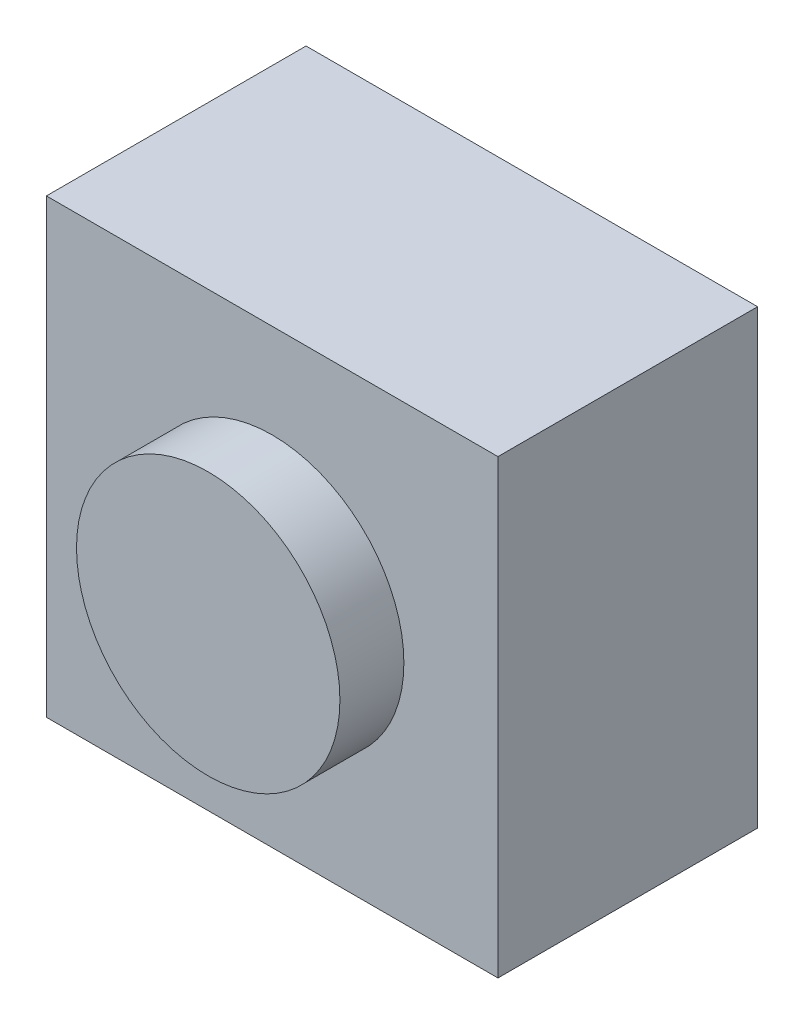
from build123d import *

# Parameters (mm, degrees)
SKETCH1_W           = 6
SKETCH1_H           = 6
BOSS_EXTRUDE1_DEPTH = 3.45
SKETCH2_R           = 1.75
BOSS_EXTRUDE3_DEPTH = 0.85


with BuildPart() as part:
    # Sketch1 → Boss-Extrude1 (new body)
    with BuildSketch(Plane.XY):
        Rectangle(SKETCH1_W, SKETCH1_H)
    extrude(amount=BOSS_EXTRUDE1_DEPTH)

    # Sketch2 → Boss-Extrude3 (add)
    with BuildSketch(Plane.XY.offset(3.45)):
        with Locations(Location((0, 0, 0), (0, 0, 180))):
            Circle(SKETCH2_R)
    extrude(amount=BOSS_EXTRUDE3_DEPTH)


solid = part.part
